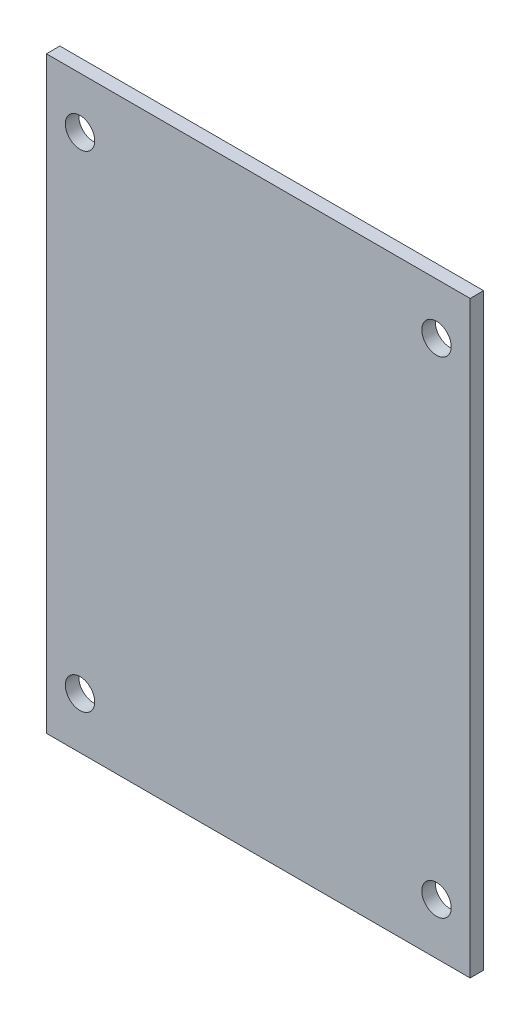
from build123d import *

# Parameters (mm, degrees)
ESQUISSE1_W               = 50.4
ESQUISSE1_H               = 70
BOSS_EXTRU_1_DEPTH        = 1.6
ESQUISSE2_R               = 1.75
ENL_V_MAT_EXTRU_1_DEPTH   = 87.271200293
SYM_TRIE2_COPY_1_SKETCH_R = 1.75
SYM_TRIE2_COPY_1_DEPTH    = 87.271200293


with BuildPart() as part:
    # Esquisse1 → Boss.-Extru.1 (new body)
    with BuildSketch(Plane.XY):
        with Locations((25.2, 35)):
            Rectangle(ESQUISSE1_W, ESQUISSE1_H)
    extrude(amount=BOSS_EXTRU_1_DEPTH)

    # Esquisse2 → Enlèv. mat.-Extru.1 (cut, through all)
    with BuildSketch(Plane.XY.offset(1.6)):
        with Locations((4, 63.9)):
            Circle(ESQUISSE2_R)
    enl_v_mat_extru_1 = extrude(amount=-ENL_V_MAT_EXTRU_1_DEPTH, mode=Mode.SUBTRACT)

    # Symétrie1: Enlèv. mat.-Extru.1 across plane
    add(enl_v_mat_extru_1.mirror(Plane.ZY.offset(-25.2)), mode=Mode.SUBTRACT)

    # Symétrie2: Enlèv. mat.-Extru.1 across plane
    add(enl_v_mat_extru_1.mirror(Plane.ZX.offset(35)), mode=Mode.SUBTRACT)

    # Symétrie2 copy 1 sketch → Symétrie2 copy 1 (cut, through all)
    with BuildSketch(Plane(origin=(50.4, 70, 1.6), x_dir=(-1, 0, 0), z_dir=(0, 0, 1))):
        with Locations((4, 63.9)):
            Circle(SYM_TRIE2_COPY_1_SKETCH_R)
    extrude(amount=-SYM_TRIE2_COPY_1_DEPTH, mode=Mode.SUBTRACT)


solid = part.part
